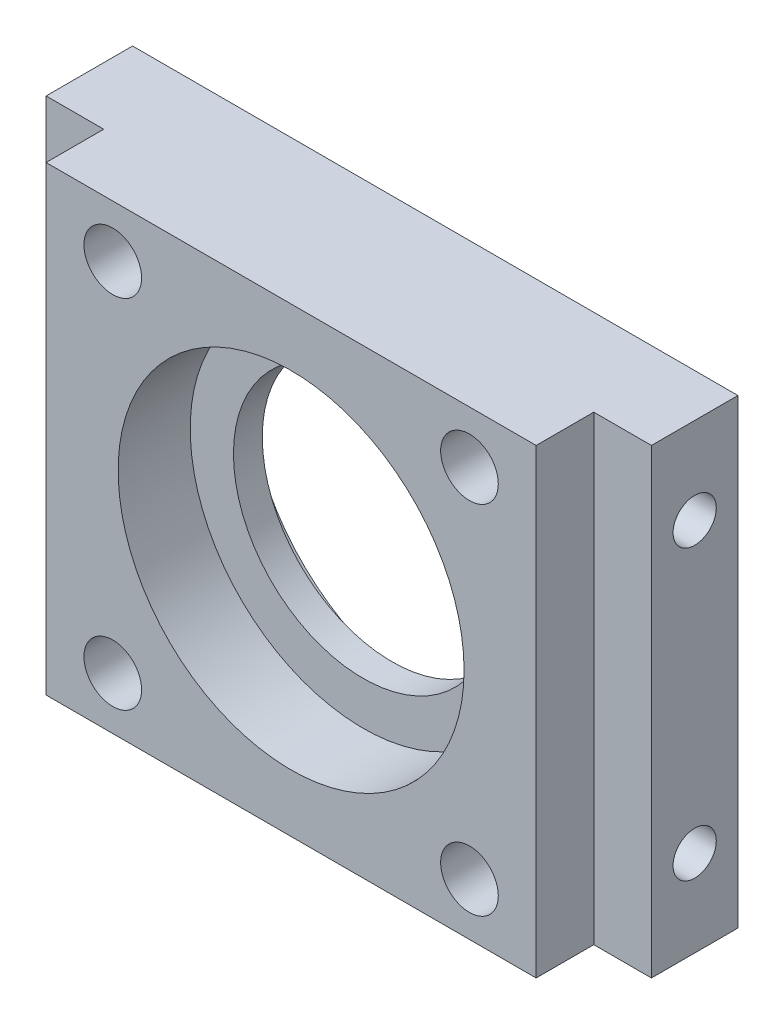
from build123d import *

# Parameters (mm, degrees)
SKETCH_1_W                    = 42
SKETCH_1_H                    = 32
EXTRUDE_1_DEPTH               = 10
SKETCH_2_W                    = 4
SKETCH_2_H                    = 4
CUT_EXTRUDE_1_DEPTH           = 40.56008089
SKETCH_3_W                    = 4
SKETCH_3_H                    = 4
CUT_EXTRUDE_2_DEPTH           = 40.56008089
HOLE_WIZARD_4_0_4_1_D         = 4
HOLE_WIZARD_3_0_3_1_D         = 3
HOLE_WIZARD_3_0_3_1_DEPTH     = 6
HOLE_WIZARD_3_0_3_2_D         = 3
HOLE_WIZARD_3_0_3_2_DEPTH     = 6
HOLE_WIZARD_M20_1_D           = 23
HOLE_WIZARD_M20_1_CBORE_D     = 24
HOLE_WIZARD_M20_1_CBORE_DEPTH = 4
SKETCH_12_R                   = 11.5
SKETCH_12_R_2                 = 9
EXTRUDE_2_DEPTH               = 6
SKETCH_13_R                   = 12
CUT_EXTRUDE_3_DEPTH           = 5
SKETCH_14_R                   = 13
CUT_EXTRUDE_4_DEPTH           = 3


with BuildPart() as part:
    # 草图1 → 凸台-拉伸1 (new body)
    with BuildSketch(Plane.XY.offset(10)):
        Rectangle(SKETCH_1_W, SKETCH_1_H)
    extrude(amount=-EXTRUDE_1_DEPTH)

    # 草图2 → 切除-拉伸1 (cut, through all)
    with BuildSketch(Plane.XZ.offset(16)):
        with Locations((-19, 8)):
            Rectangle(SKETCH_2_W, SKETCH_2_H)
    extrude(amount=-CUT_EXTRUDE_1_DEPTH, mode=Mode.SUBTRACT)

    # 草图3 → 切除-拉伸2 (cut, through all)
    with BuildSketch(Plane.XZ.offset(16)):
        with Locations((19, 8)):
            Rectangle(SKETCH_3_W, SKETCH_3_H)
    extrude(amount=-CUT_EXTRUDE_2_DEPTH, mode=Mode.SUBTRACT)

    # Ø4.0 (4) 直径孔1 (through all)
    with Locations(Plane.XY.offset(10)):
        with Locations((12.374368671, 12.374368671), (12.374368671, -12.374368671), (-12.374368671, -12.374368671), (-12.374368671, 12.374368671)):
            Hole(HOLE_WIZARD_4_0_4_1_D / 2)

    # Ø3.0 (3) 直径孔1
    with Locations(Plane(origin=(21, 0, 0), x_dir=(0, 0, -1), z_dir=(1, 0, 0))):
        with Locations((-3, -10), (-3, 10)):
            Hole(HOLE_WIZARD_3_0_3_1_D / 2, depth=HOLE_WIZARD_3_0_3_1_DEPTH)

    # Ø3.0 (3) 直径孔2
    with Locations(Plane.ZY.offset(21)):
        with Locations((3, -10), (3, 10)):
            Hole(HOLE_WIZARD_3_0_3_2_D / 2, depth=HOLE_WIZARD_3_0_3_2_DEPTH)

    # M20 六角头螺栓的柱形沉头孔1 (through all)
    with Locations(Plane.XY.offset(10)):
        with Locations((0, 0)):
            CounterBoreHole(HOLE_WIZARD_M20_1_D / 2, HOLE_WIZARD_M20_1_CBORE_D / 2, HOLE_WIZARD_M20_1_CBORE_DEPTH)

    # 草图12 → 凸台-拉伸2 (add)
    with BuildSketch(Plane(origin=(0, 0, 0), x_dir=(-1, 0, 0), z_dir=(0, 0, -1))):
        Circle(SKETCH_12_R)
        Circle(SKETCH_12_R_2, mode=Mode.SUBTRACT)
    extrude(amount=-EXTRUDE_2_DEPTH)

    # 草图13 → 切除-拉伸3 (cut)
    with BuildSketch(Plane.XY.offset(10)):
        Circle(SKETCH_13_R)
    extrude(amount=-CUT_EXTRUDE_3_DEPTH, mode=Mode.SUBTRACT)

    # 草图14 → 切除-拉伸4 (cut)
    with BuildSketch(Plane(origin=(0, 0, 0), x_dir=(-1, 0, 0), z_dir=(0, 0, -1))):
        Circle(SKETCH_14_R)
    extrude(amount=-CUT_EXTRUDE_4_DEPTH, mode=Mode.SUBTRACT)


solid = part.part
